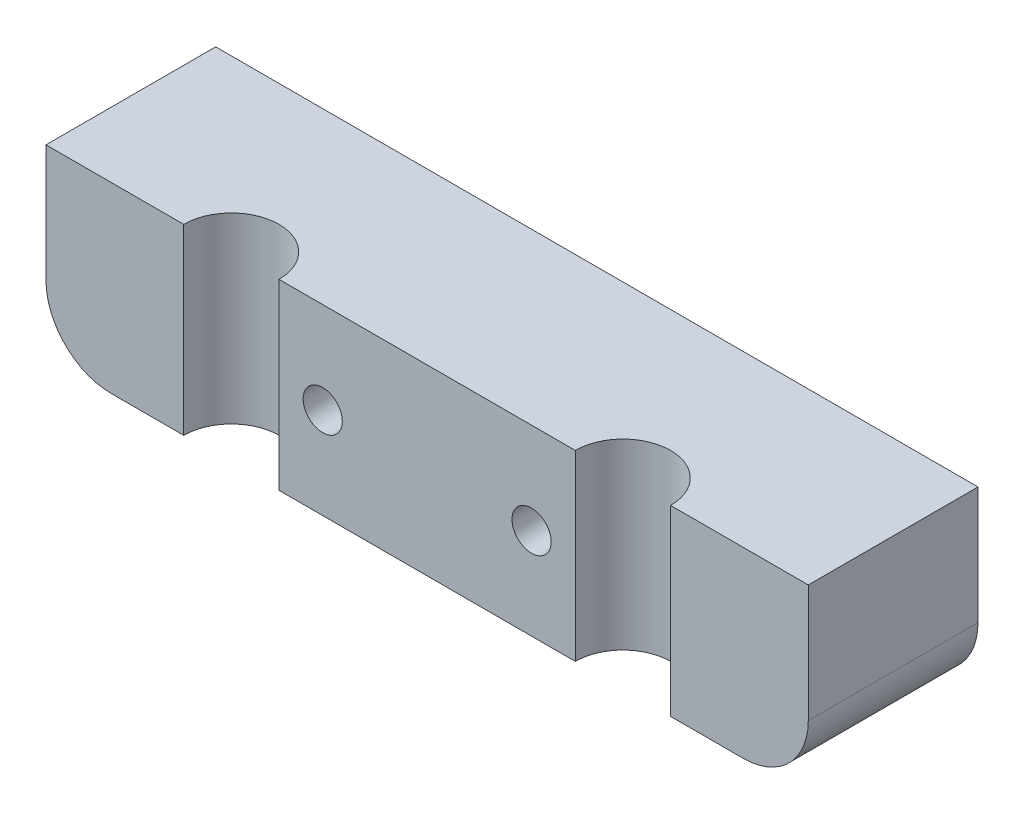
from build123d import *

# Parameters (mm, degrees)
SKETCH_1_W          = 58.4
SKETCH_1_H          = 14
EXTRUDE_1_DEPTH     = 13
CUT_EXTRUDE_1_REACH = 34.721
SKETCH_2_R          = 1.5
CUT_EXTRUDE_2_REACH = 36.895
SKETCH_3_R          = 3.65
SKETCH_4_R          = 3
CUT_EXTRUDE_3_DEPTH = 3.8
FILLET_1_R          = 5


with BuildPart() as part:
    # Эскиз1 → Бобышка-Вытянуть1 (new body)
    with BuildSketch(Plane.XY):
        Rectangle(SKETCH_1_W, SKETCH_1_H)
    extrude(amount=EXTRUDE_1_DEPTH)

    # Эскиз2 → Вырез-Вытянуть1 (cut, up to next)
    with BuildSketch(Plane.XY.offset(13), mode=Mode.PRIVATE) as cut_extrude_1_sk1:
        with Locations((-8, 0)):
            Circle(SKETCH_2_R)
    cut_extrude_1_tool1 = extrude(cut_extrude_1_sk1.sketch, amount=-CUT_EXTRUDE_1_REACH, mode=Mode.PRIVATE) & part.part
    # Эскиз2 → Вырез-Вытянуть1 (cut, up to next)
    with BuildSketch(Plane.XY.offset(13), mode=Mode.PRIVATE) as cut_extrude_1_sk2:
        with Locations(Location((8, 0, 0), (0, 0, 180))):
            Circle(SKETCH_2_R)
    cut_extrude_1_tool2 = extrude(cut_extrude_1_sk2.sketch, amount=-CUT_EXTRUDE_1_REACH, mode=Mode.PRIVATE) & part.part
    add(cut_extrude_1_tool1.solids().sort_by_distance((-8, 0, 13))[0], mode=Mode.SUBTRACT)
    add(cut_extrude_1_tool2.solids().sort_by_distance((8, 0, 13))[0], mode=Mode.SUBTRACT)

    # Эскиз3 → Вырез-Вытянуть2 (cut, up to next)
    with BuildSketch(Plane(origin=(0, 7, 0), x_dir=(1, 0, 0), z_dir=(0, 1, 0)), mode=Mode.PRIVATE) as cut_extrude_2_sk1:
        with Locations((-15, -13)):
            Circle(SKETCH_3_R)
    cut_extrude_2_tool1 = extrude(cut_extrude_2_sk1.sketch, amount=-CUT_EXTRUDE_2_REACH, mode=Mode.PRIVATE) & part.part
    # Эскиз3 → Вырез-Вытянуть2 (cut, up to next)
    with BuildSketch(Plane(origin=(0, 7, 0), x_dir=(1, 0, 0), z_dir=(0, 1, 0)), mode=Mode.PRIVATE) as cut_extrude_2_sk2:
        with Locations((15, -13)):
            Circle(SKETCH_3_R)
    cut_extrude_2_tool2 = extrude(cut_extrude_2_sk2.sketch, amount=-CUT_EXTRUDE_2_REACH, mode=Mode.PRIVATE) & part.part
    add(cut_extrude_2_tool1.solids().sort_by_distance((-15, 7, 13))[0], mode=Mode.SUBTRACT)
    add(cut_extrude_2_tool2.solids().sort_by_distance((15, 7, 13))[0], mode=Mode.SUBTRACT)

    # Эскиз4 → Вырез-Вытянуть3 (cut)
    with BuildSketch(Plane(origin=(0, 0, 0), x_dir=(-1, 0, 0), z_dir=(0, 0, -1))):
        with Locations((-8, 0)):
            Circle(SKETCH_4_R)
        with Locations((8, 0)):
            Circle(SKETCH_4_R)
    extrude(amount=-CUT_EXTRUDE_3_DEPTH, mode=Mode.SUBTRACT)

    # Скругление1
    fillet_1_edges = [part.edges().sort_by_distance(p)[0] for p in [
        (29.2, -7, 6.5),
        (-29.2, -7, 6.5),
    ]]
    fillet(fillet_1_edges, radius=FILLET_1_R)


solid = part.part
